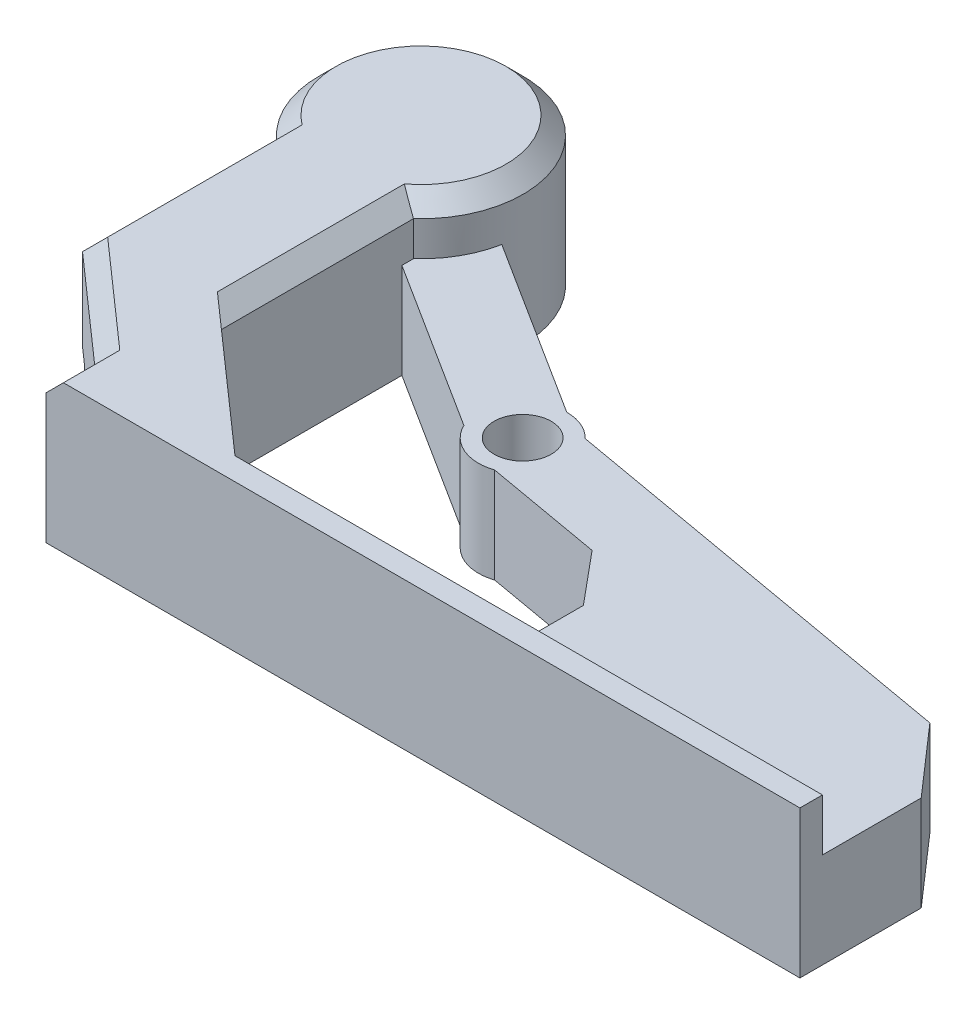
from build123d import *

# Parameters (mm, degrees)
BOSS_EXTRUDE1_DEPTH = 5.5
SKETCH2_R           = 1.65
CUT_EXTRUDE1_DEPTH  = 5.5
BOSS_EXTRUDE2_DEPTH = 3
CUT_EXTRUDE2_DEPTH  = 2.75
SKETCH5_R           = 1.95
SKETCH5_R_2         = 1.35
SKETCH5_R_3         = 1.15
SKETCH5_R_4         = 2
CUT_EXTRUDE3_DEPTH  = 4.3
SKETCH7_R           = 1.95
SKETCH7_R_2         = 1.35
CUT_EXTRUDE4_DEPTH  = 3
CHAMFER1_SIZE       = 1
CUT_EXTRUDE5_DEPTH  = 2.75


with BuildPart() as part:
    # Sketch1 → Boss-Extrude1 (new body)
    with BuildSketch(Plane(origin=(0, 0, 0), x_dir=(1, 0, 0), z_dir=(0, 1, 0))):
        with BuildLine():
            Line((-7.755996733, 16.049992949), (-18.008818061, 22.554712546))
            ThreePointArc((-18.008818061, 22.554712546), (-25.669699487, 29.278547542), (-27.75, 19.3))
            Line((-27.75, 19.3), (-27.75, 8.1))
            Line((-27.75, 8.1), (-21.75, 2.8))
            Line((-21.75, 2.8), (-21.75, 0))
            Line((-21.75, 0), (21.75, 0))
            Line((21.75, 0), (21.75, 7))
            Line((21.75, 7), (18.25, 11))
            Line((18.25, 11), (-5.907756778, 15.263133549))
            ThreePointArc((-5.907756778, 15.263133549), (-6.75113203, 15.846223088), (-7.755996733, 16.049992949))
        make_face()
        with BuildLine():
            Line((-19.85, 18.630440726), (-10.05956754, 12.419075498))
            ThreePointArc((-10.05956754, 12.419075498), (-8.75757921, 11.15750472), (-6.94630287, 11.079964685))
            Line((-6.94630287, 11.079964685), (-0.119008465, 9.875148026))
            Line((-0.119008465, 9.875148026), (2.380991535, 6.875148026))
            Line((2.380991535, 6.875148026), (2.380991535, 1.3))
            Line((2.380991535, 1.3), (-12.151886792, 1.3))
            Line((-12.151886792, 1.3), (-19.85, 8.1))
            Line((-19.85, 8.1), (-19.85, 18.630440726))
        make_face(mode=Mode.SUBTRACT)
    extrude(amount=BOSS_EXTRUDE1_DEPTH)

    # Sketch2 → Cut-Extrude1 (cut)
    with BuildSketch(Plane(origin=(0, 5.5, 0), x_dir=(1, 0, 0), z_dir=(0, 1, 0))):
        with Locations(Location((-7.75, 13.5, 0), (0, 0, 270))):
            Circle(SKETCH2_R)
    extrude(amount=-CUT_EXTRUDE1_DEPTH, mode=Mode.SUBTRACT)

    # Sketch3 → Boss-Extrude2 (add)
    with BuildSketch(Plane(origin=(0, 5.5, 0), x_dir=(1, 0, 0), z_dir=(0, 1, 0))):
        with BuildLine():
            ThreePointArc((-27.75, 19.3), (-23.8, 17.782636193), (-19.85, 19.3))
            ThreePointArc((-19.85, 19.3), (-18.664735174, 20.777631), (-18.008818061, 22.554712546))
            ThreePointArc((-18.008818061, 22.554712546), (-17.927267525, 23.116055854), (-17.9, 23.682636193))
            ThreePointArc((-17.9, 23.682636193), (-26.198436991, 29.073137097), (-27.75, 19.3))
        make_face()
        with BuildLine():
            Line((-12.151886792, 1.3), (-19.85, 8.1))
            Line((-19.85, 8.1), (-19.85, 18.630440726))
            Line((-19.85, 18.630440726), (-19.85, 19.3))
            ThreePointArc((-19.85, 19.3), (-23.8, 17.782636193), (-27.75, 19.3))
            Line((-27.75, 19.3), (-27.75, 8.1))
            Line((-27.75, 8.1), (-21.75, 2.8))
            Line((-21.75, 2.8), (-21.75, 0))
            Line((-21.75, 0), (21.75, 0))
            Line((21.75, 0), (21.75, 1.3))
            Line((21.75, 1.3), (2.380991535, 1.3))
            Line((2.380991535, 1.3), (-12.151886792, 1.3))
        make_face()
    extrude(amount=BOSS_EXTRUDE2_DEPTH)

    # Sketch4 → Cut-Extrude2 (cut)
    with BuildSketch(Plane.XZ):
        with BuildLine():
            ThreePointArc((-27.75, -19.3), (-29.307610804, -25.798344876), (-23.8, -29.582636193))
            Line((-23.8, -29.582636193), (-23.8, -7.3))
            Line((-23.8, -7.3), (-26.844339623, -7.3))
            Line((-26.844339623, -7.3), (-27.75, -8.1))
            Line((-27.75, -8.1), (-27.75, -19.3))
        make_face()
    extrude(amount=-CUT_EXTRUDE2_DEPTH, mode=Mode.SUBTRACT)

    # Sketch5 → Cut-Extrude3 (cut)
    with BuildSketch(Plane.XZ):
        with Locations(Location((-23.8, -23.682636193, 0), (0, 0, 90))):
            Circle(SKETCH5_R)
        with Locations(Location((-23.8, -13.882636193, 0), (0, 0, 90))):
            Circle(SKETCH5_R_2)
        with Locations(Location((-20, -4.382636193, 0), (0, 0, 270))):
            Circle(SKETCH5_R_3)
        with Locations(Location((15.000589162, -5.5, 0), (0, 0, 270))):
            Circle(SKETCH5_R_4)
    extrude(amount=-CUT_EXTRUDE3_DEPTH, mode=Mode.SUBTRACT)

    # Sketch7 → Cut-Extrude4 (cut)
    with BuildSketch(Plane.XZ.offset(-4.3)):
        with Locations(Location((-23.8, -23.682636193, 0), (0, 0, 90))):
            Circle(SKETCH7_R)
        with Locations(Location((-23.8, -13.882636193, 0), (0, 0, 90))):
            Circle(SKETCH7_R_2)
    extrude(amount=-CUT_EXTRUDE4_DEPTH, mode=Mode.SUBTRACT)

    # Chamfer1
    chamfer1_edges = [part.edges().sort_by_distance(p)[0] for p in [
        (-23.8, 8.5, -29.582636193),
        (-27.75, 8.5, -13.7),
        (-24.75, 8.5, -5.45),
        (-21.75, 8.5, -1.4),
        (-19.85, 8.5, -13.7),
    ]]
    chamfer(chamfer1_edges, length=CHAMFER1_SIZE)

    # Sketch8 → Cut-Extrude5 (cut)
    with BuildSketch(Plane.XZ):
        with BuildLine():
            Line((-21.05, -7.3), (-23.8, -7.3))
            Line((-23.8, -7.3), (-23.8, -12.532636193))
            ThreePointArc((-23.8, -12.532636193), (-22.45, -13.882636193), (-23.8, -15.232636193))
            Line((-23.8, -15.232636193), (-23.8, -18.982636193))
            ThreePointArc((-23.8, -18.982636193), (-22.355013861, -19.210274953), (-21.05, -19.871140424))
            Line((-21.05, -19.871140424), (-21.05, -7.3))
        make_face()
        with BuildLine():
            ThreePointArc((-19.1, -23.682636193), (-19.615803542, -21.54195873), (-21.05, -19.871140424))
            ThreePointArc((-21.05, -19.871140424), (-22.355013861, -19.210274953), (-23.8, -18.982636193))
            Line((-23.8, -18.982636193), (-23.8, -21.732636193))
            ThreePointArc((-23.8, -21.732636193), (-21.85, -23.682636193), (-23.8, -25.632636193))
            Line((-23.8, -25.632636193), (-23.8, -28.382636193))
            ThreePointArc((-23.8, -28.382636193), (-20.476598128, -27.006038065), (-19.1, -23.682636193))
        make_face()
        with BuildLine():
            Line((-23.8, -21.732636193), (-23.8, -18.982636193))
            ThreePointArc((-23.8, -18.982636193), (-28.5, -23.682636193), (-23.8, -28.382636193))
            Line((-23.8, -28.382636193), (-23.8, -25.632636193))
            ThreePointArc((-23.8, -25.632636193), (-21.85, -23.682636193), (-23.8, -21.732636193))
        make_face()
    extrude(amount=-CUT_EXTRUDE5_DEPTH, mode=Mode.SUBTRACT)


solid = part.part
